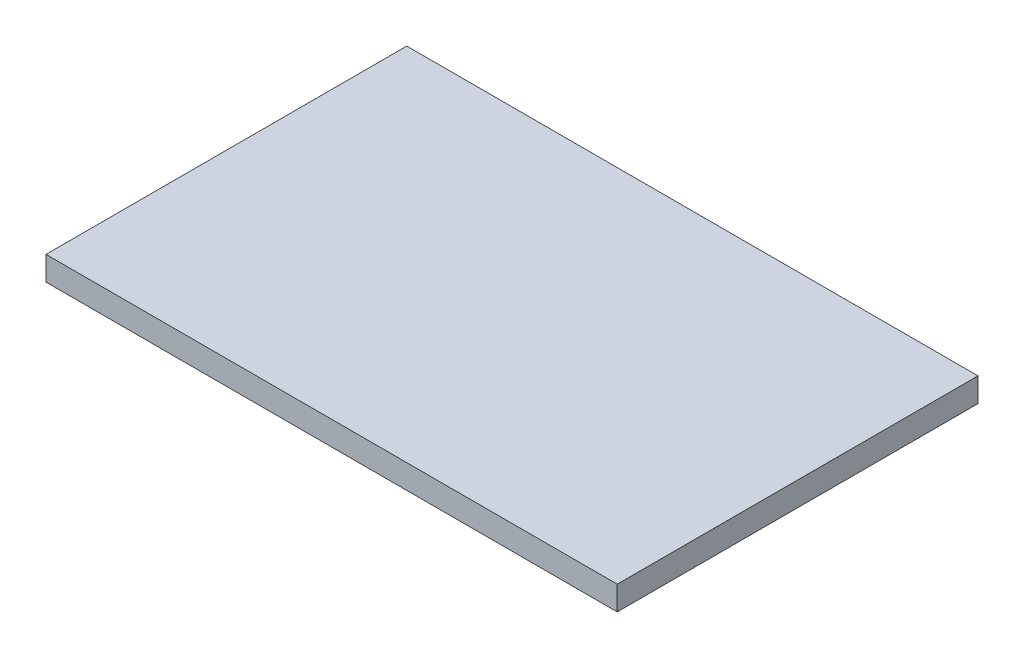
from build123d import *

# Parameters (mm, degrees)
SKETCH_1_W      = 95
SKETCH_1_H      = 60
EXTRUDE_1_DEPTH = 4


with BuildPart() as part:
    # 草图1 → 凸台-拉伸1 (new body)
    with BuildSketch(Plane(origin=(0, 0, 0), x_dir=(1, 0, 0), z_dir=(0, 1, 0))):
        Rectangle(SKETCH_1_W, SKETCH_1_H)
    extrude(amount=EXTRUDE_1_DEPTH)


solid = part.part
